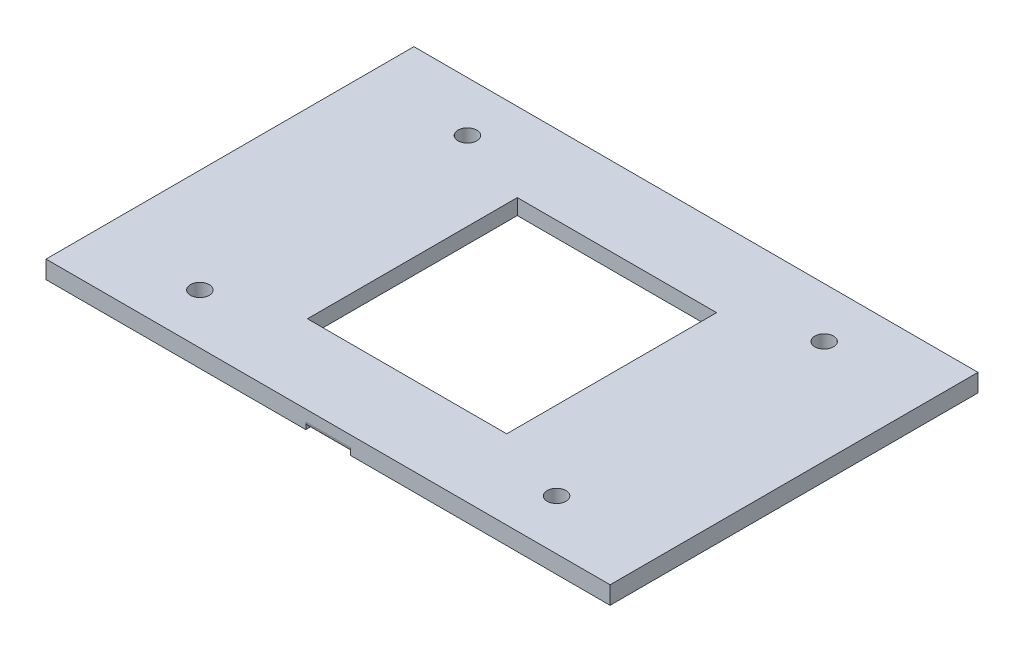
from build123d import *

# Parameters (mm, degrees)
SKETCH_1_W          = 126.5
SKETCH_1_H          = 82.5
SKETCH_1_R          = 2.1
SKETCH_1_W_2        = 44.684550296
SKETCH_1_H_2        = 47.068057481
EXTRUDE_1_DEPTH     = 4
CUT_EXTRUDE_1_DEPTH = 0.5
FILLET_1_R          = 1


with BuildPart() as part:
    # Эскиз1 → Бобышка-Вытянуть1 (new body)
    with BuildSketch(Plane(origin=(0, 60.645974268, 0), x_dir=(-1, 0, 0), z_dir=(0, -1, 0))):
        with Locations((-64.808980694, -89.523129836)):
            Rectangle(SKETCH_1_W, SKETCH_1_H)
        with Locations(Location((-24.808980694, -59.523129836, 0), (0, 0, 90))):
            Circle(SKETCH_1_R, mode=Mode.SUBTRACT)
        with Locations(Location((-104.808980694, -59.523129836, 0), (0, 0, 90))):
            Circle(SKETCH_1_R, mode=Mode.SUBTRACT)
        with Locations(Location((-24.808980694, -119.523129836, 0), (0, 0, 90))):
            Circle(SKETCH_1_R, mode=Mode.SUBTRACT)
        with Locations(Location((-104.808980694, -119.523129836, 0), (0, 0, 90))):
            Circle(SKETCH_1_R, mode=Mode.SUBTRACT)
        with Locations((-64.808980694, -89.523129837)):
            Rectangle(SKETCH_1_W_2, SKETCH_1_H_2, mode=Mode.SUBTRACT)
    extrude(amount=EXTRUDE_1_DEPTH)

    # Эскиз3 → Вырез-Вытянуть1 (cut)
    with BuildSketch(Plane(origin=(0, 56.645974268, 0), x_dir=(-1, 0, 0), z_dir=(0, -1, 0))):
        Polygon((-59.808980694, -57.523129836), (-32.808980694, -57.523129836), (-32.808980694, -84.523129836), (-12.808980694, -84.523129836), (-12.808980694, -94.523129836), (-32.808980694, -94.523129836), (-32.808980694, -121.523129836), (-59.808980694, -121.523129836), (-59.808980694, -130.773129836), (-69.808980694, -130.773129836), (-69.808980694, -121.523129836), (-96.808980694, -121.523129836), (-96.808980694, -94.523129836), (-116.808980694, -94.523129836), (-116.808980694, -84.523129836), (-96.808980694, -84.523129836), (-96.808980694, -57.523129836), (-69.808980694, -57.523129836), (-69.808980694, -48.273129836), (-59.808980694, -48.273129836), align=None)
    extrude(amount=-CUT_EXTRUDE_1_DEPTH, mode=Mode.SUBTRACT)

    # Скругление1
    fillet_1_edges = [part.edges().sort_by_distance(p)[0] for p in [
        (64.808980694, 57.145974268, 130.773129836),
        (64.808980694, 57.145974268, 48.273129836),
    ]]
    fillet(fillet_1_edges, radius=FILLET_1_R)


solid = part.part
